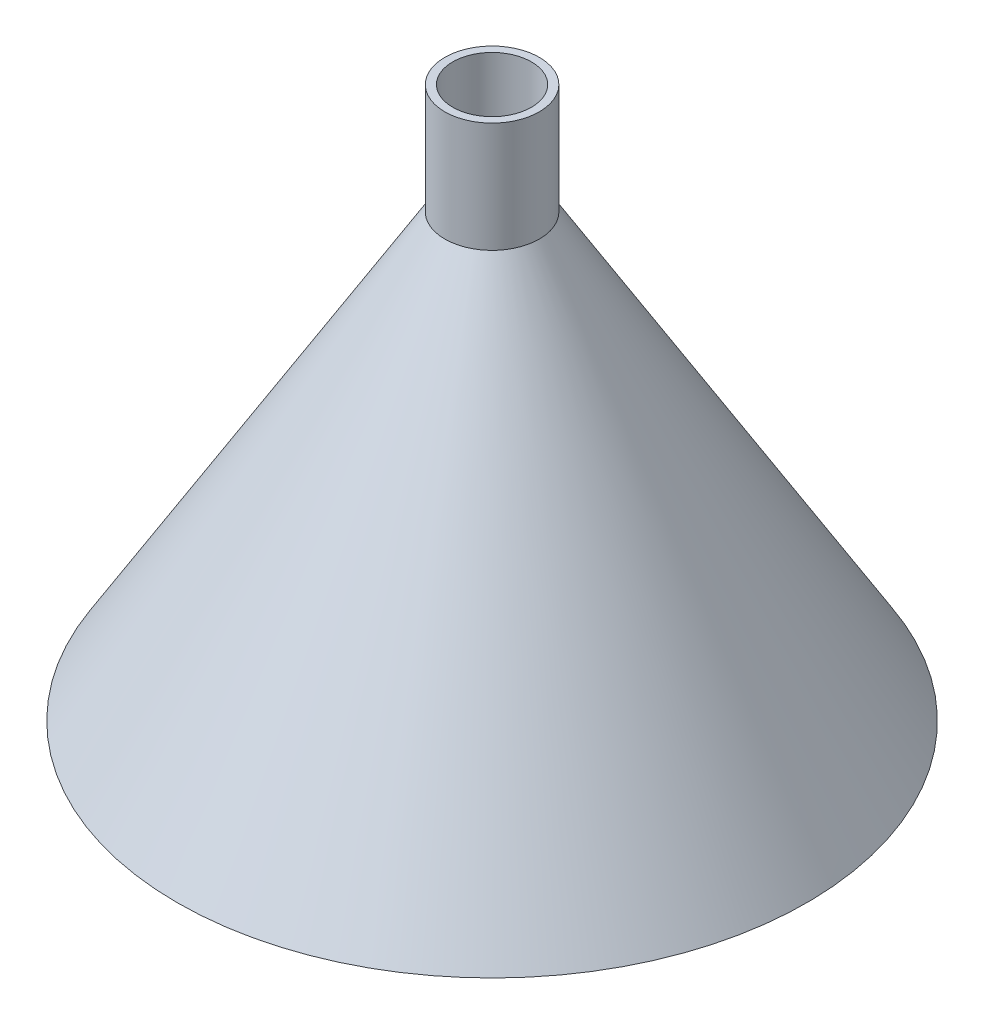
from build123d import *

# Parameters (mm, degrees)
SKETCH1_R           = 100
BOSS_EXTRUDE3_DEPTH = 140
BOSS_EXTRUDE3_TAPER = 31.3
SKETCH2_R           = 97.5
CUT_EXTRUDE1_DEPTH  = 140
CUT_EXTRUDE1_DRAFT  = -31.3
SKETCH4_R           = 15
SKETCH4_R_2         = 12.5
EXTRUDE_THIN1_DEPTH = 35


with BuildPart() as part:
    # Sketch1 → Boss-Extrude3 (new body)
    with BuildSketch(Plane(origin=(0, 0, 0), x_dir=(1, 0, 0), z_dir=(0, 1, 0))):
        Circle(SKETCH1_R)
    extrude(amount=BOSS_EXTRUDE3_DEPTH, taper=BOSS_EXTRUDE3_TAPER)


with BuildPart() as cut_extrude1_tool:
    # Sketch2 → Cut-Extrude1 (with draft: the straight prism first)
    with BuildSketch(Plane.XZ):
        Circle(SKETCH2_R)
    extrude(amount=-CUT_EXTRUDE1_DEPTH)
    # Cut-Extrude1: the draft: its side faces are tilted about the plane it starts from
    cut_extrude1_sides = [cut_extrude1_tool.faces().sort_by_distance(p)[0] for p in [
        (-97.5, 70, 0),
    ]]
    draft(cut_extrude1_sides, Plane.XZ, CUT_EXTRUDE1_DRAFT)


with BuildPart() as part_1:
    add(part.part)

    # Cut-Extrude1: cut by cut_extrude1_tool
    add(cut_extrude1_tool.part, mode=Mode.SUBTRACT)

    # Sketch4 → Extrude-Thin1 (add)
    with BuildSketch(Plane(origin=(0, 140, 0), x_dir=(1, 0, 0), z_dir=(0, 1, 0))):
        Circle(SKETCH4_R)
        Circle(SKETCH4_R_2, mode=Mode.SUBTRACT)
    extrude(amount=EXTRUDE_THIN1_DEPTH)


solid = part_1.part
